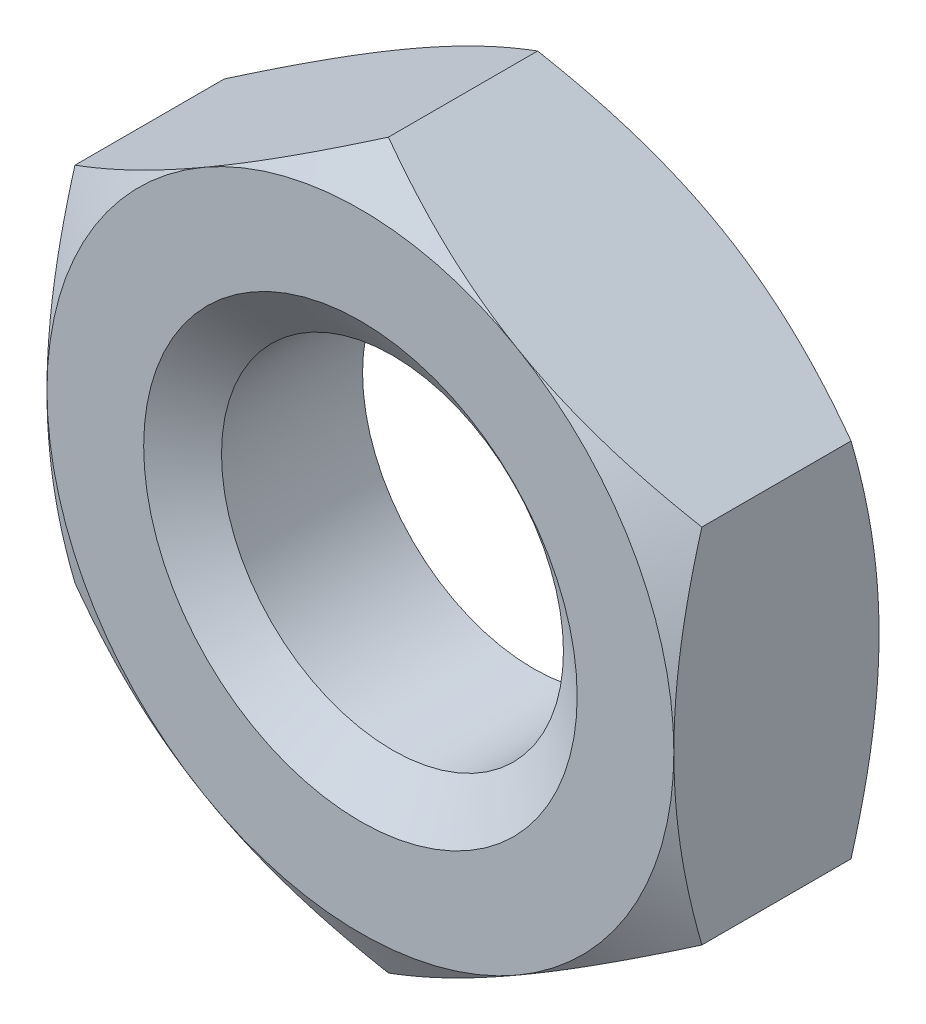
from build123d import *

# Parameters (mm, degrees)
BASENUTSKE_R  = 1.5
BASENUT_DEPTH = 1.8


with BuildPart() as part:
    # BaseNutSke → BaseNut (new body)
    with BuildSketch(Plane.XY):
        Polygon((2.75, 1.58771324), (2.75, -1.58771324), (0, -3.175426481), (-2.75, -1.58771324), (-2.75, 1.58771324), (0, 3.175426481), align=None)
        Circle(BASENUTSKE_R, mode=Mode.SUBTRACT)
    extrude(amount=-BASENUT_DEPTH)

    # Sketch3 → Double-Chamfer (revolve, cut)
    with BuildSketch(Plane(origin=(0, 0, 0), x_dir=(0, 0, -1), z_dir=(1, 0, 0))):
        Polygon((1.8, 2.75), (1.554379907, 3.175426481), (1.554379907, 13.175426481), (11.8, 13.175426481), (11.8, 2.75), align=None)
        Polygon((0.245620093, 13.175426481), (-10, 13.175426481), (-10, 2.75), (0, 2.75), (0.245620093, 3.175426481), align=None)
    revolve(axis=Axis((0, 0, 0), (0, 0, -1)), mode=Mode.SUBTRACT)

    # Sketch5 → EndChamfer (revolve, cut)
    with BuildSketch(Plane(origin=(0, 0, 0), x_dir=(0, 0, -1), z_dir=(1, 0, 0)), mode=Mode.PRIVATE) as endchamfer_sk:
        Polygon((0, 1.901666627), (0.28125, 1.5), (0, 1.5), align=None)
        Polygon((1.8, 1.901666627), (1.8, 1.5), (1.51875, 1.5), align=None)
    revolve(endchamfer_sk.sketch.rotate(Axis((0, 0, 0), (0, 0, -1)), 90), axis=Axis((0, 0, 0), (0, 0, -1)), mode=Mode.SUBTRACT)


solid = part.part
